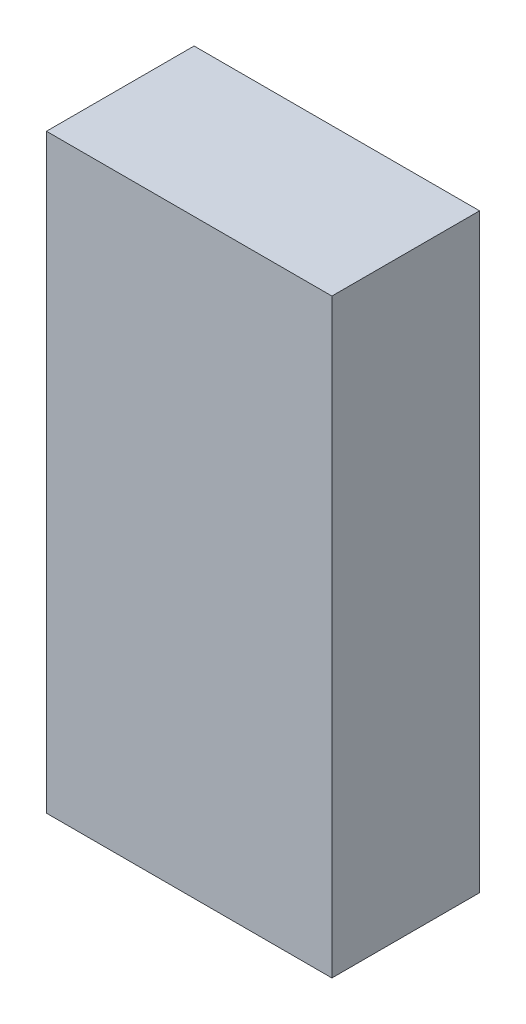
from build123d import *

# Parameters (mm, degrees)
SKETCH_2_W      = 870
SKETCH_2_H      = 450
EXTRUDE_1_DEPTH = 1800


with BuildPart() as part:
    # ｽｹｯﾁ2 → ﾎﾞｽ - 押し出し1 (new body)
    with BuildSketch(Plane(origin=(0, 0, 0), x_dir=(1, 0, 0), z_dir=(0, 1, 0))):
        with Locations((435, 225)):
            Rectangle(SKETCH_2_W, SKETCH_2_H)
    extrude(amount=EXTRUDE_1_DEPTH)


solid = part.part
